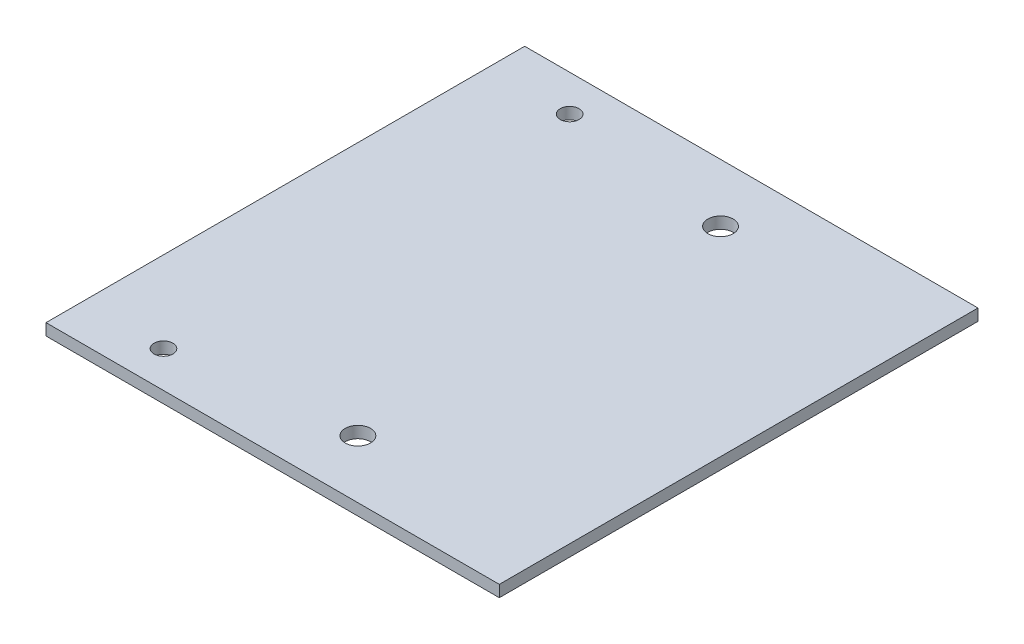
from build123d import *

# Parameters (mm, degrees)
SKETCH1_W           = 62.5
SKETCH1_H           = 66
BOSS_EXTRUDE1_DEPTH = 1.6
SKETCH2_R           = 1.3
CUT_EXTRUDE1_DEPTH  = 10
CUT_EXTRUDE2_REACH  = 47.477
SKETCH3_R           = 1.75


with BuildPart() as part:
    # Sketch1 → Boss-Extrude1 (new body)
    with BuildSketch(Plane(origin=(0, 0, 0), x_dir=(1, 0, 0), z_dir=(0, 1, 0))):
        Rectangle(SKETCH1_W, SKETCH1_H)
    extrude(amount=BOSS_EXTRUDE1_DEPTH)

    # Sketch2 → Cut-Extrude1 (cut)
    with BuildSketch(Plane(origin=(0, 1.6, 0), x_dir=(1, 0, 0), z_dir=(0, 1, 0))):
        with Locations(Location((-20.052, 28, 0), (0, 0, 270))):
            Circle(SKETCH2_R)
        with Locations(Location((-20.052, -28, 0), (0, 0, 270))):
            Circle(SKETCH2_R)
    extrude(amount=-CUT_EXTRUDE1_DEPTH, mode=Mode.SUBTRACT)

    # Sketch3 → Cut-Extrude2 (cut, up to next)
    with BuildSketch(Plane(origin=(0, 1.6, 0), x_dir=(1, 0, 0), z_dir=(0, 1, 0)), mode=Mode.PRIVATE) as cut_extrude2_sk1:
        with Locations(Location((3.75, 25, 0), (0, 0, 270))):
            Circle(SKETCH3_R)
    cut_extrude2_tool1 = extrude(cut_extrude2_sk1.sketch, amount=-CUT_EXTRUDE2_REACH, mode=Mode.PRIVATE) & part.part
    # Sketch3 → Cut-Extrude2 (cut, up to next)
    with BuildSketch(Plane(origin=(0, 1.6, 0), x_dir=(1, 0, 0), z_dir=(0, 1, 0)), mode=Mode.PRIVATE) as cut_extrude2_sk2:
        with Locations(Location((3.75, -25, 0), (0, 0, 270))):
            Circle(SKETCH3_R)
    cut_extrude2_tool2 = extrude(cut_extrude2_sk2.sketch, amount=-CUT_EXTRUDE2_REACH, mode=Mode.PRIVATE) & part.part
    add(cut_extrude2_tool1.solids().sort_by_distance((3.75, 1.6, -25))[0], mode=Mode.SUBTRACT)
    add(cut_extrude2_tool2.solids().sort_by_distance((3.75, 1.6, 25))[0], mode=Mode.SUBTRACT)


solid = part.part
